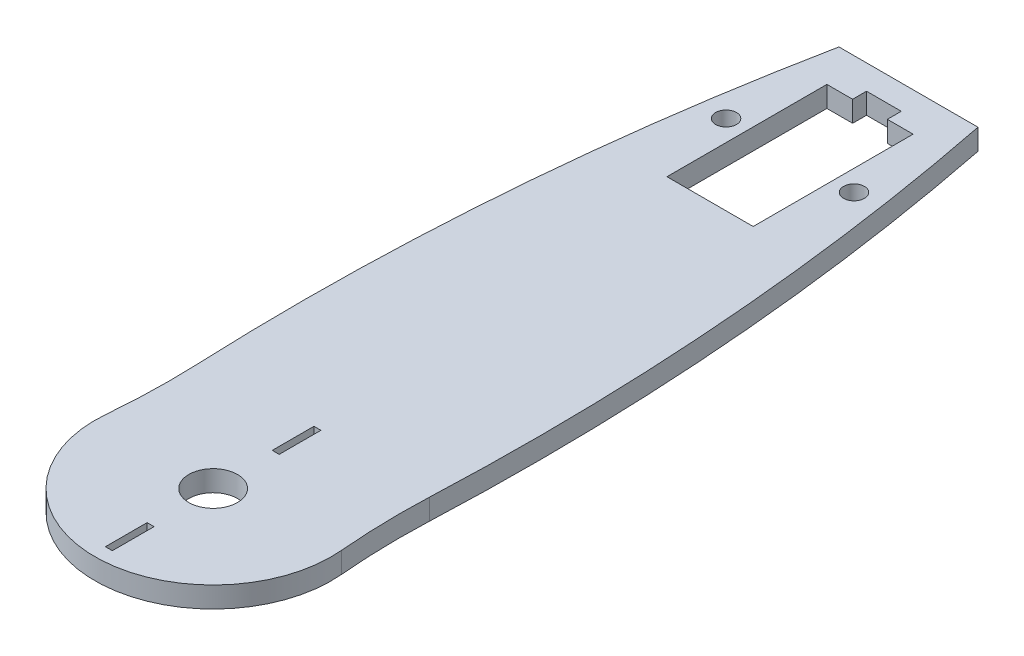
from build123d import *

# Parameters (mm, degrees)
ESBO_O4_R                = 3.5
ESBO_O4_R_2              = 1.5
RESSALTO_EXTRUS_O1_DEPTH = 3


with BuildPart() as part:
    # Esboço4 → Ressalto-extrusão1 (new body)
    with BuildSketch(Plane(origin=(0, 0, 0), x_dir=(1, 0, 0), z_dir=(0, 1, 0))):
        with BuildLine():
            Line((0, 100), (10, 100))
            ThreePointArc((10, 100), (15.870896117, 57.454662802), (16.6322809, 14.512918173))
            ThreePointArc((16.6322809, 14.512918173), (16.571046781, 8.001087588), (16.933775774, 1.499079062))
            ThreePointArc((16.933775774, 1.499079062), (0, -17), (-16.933775774, 1.499079062))
            ThreePointArc((-16.933775774, 1.499079062), (-16.571046781, 8.001087588), (-16.6322809, 14.512918173))
            ThreePointArc((-16.6322809, 14.512918173), (-15.870896117, 57.454662802), (-10, 100))
            Line((-10, 100), (0, 100))
        make_face()
        with Locations(Location((0, 0, 0), (0, 0, 270))):
            Circle(ESBO_O4_R, mode=Mode.SUBTRACT)
        with Locations(Location((9.2, 82.966613318, 0), (0, 0, 270))):
            Circle(ESBO_O4_R_2, mode=Mode.SUBTRACT)
        with Locations(Location((-9.2, 82.966613318, 0), (0, 0, 90))):
            Circle(ESBO_O4_R_2, mode=Mode.SUBTRACT)
        Polygon((6.2, 94.466613318), (6.2, 71.466613318), (-6.2, 71.466613318), (-6.2, 94.466613318), (-2.5, 94.466613318), (-2.5, 96.466613318), (2.5, 96.466613318), (2.5, 94.466613318), align=None, mode=Mode.SUBTRACT)
        Polygon((0, -15), (-0.5, -15), (-0.5, -9), (0.5, -9), (0.5, -15), align=None, mode=Mode.SUBTRACT)
        Polygon((0.5, 15), (0, 15), (-0.5, 15), (-0.5, 9), (0.5, 9), align=None, mode=Mode.SUBTRACT)
    extrude(amount=RESSALTO_EXTRUS_O1_DEPTH)


solid = part.part
